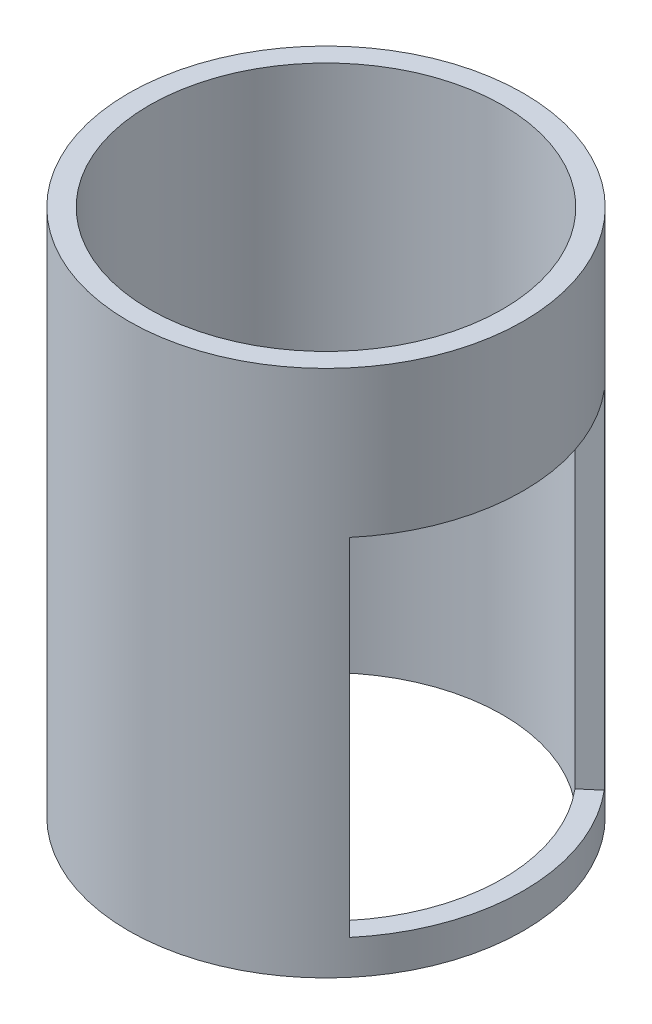
from build123d import *

# Parameters (mm, degrees)
PVC_R               = 57
PVC_R_2             = 51
BOSS_EXTRUDE1_DEPTH = 76.2
CUT_EXTRUDE1_START  = -110
CUT_EXTRUDE1_DEPTH  = 100


with BuildPart() as part:
    # PVC → Boss-Extrude1 (new, symmetric)
    with BuildSketch(Plane(origin=(0, 0, 0), x_dir=(1, 0, 0), z_dir=(0, 1, 0))):
        with Locations(Location((0, 0, 0), (0, 0, 90))):
            Circle(PVC_R)
        with Locations(Location((0, 0, 0), (0, 0, 90))):
            Circle(PVC_R_2, mode=Mode.SUBTRACT)
    extrude(amount=BOSS_EXTRUDE1_DEPTH, both=True)

    # Sketch1 → Cut-Extrude1 (cut)
    with BuildSketch(Plane.XZ.offset(76.2).offset(CUT_EXTRUDE1_START)):
        with BuildLine():
            Line((0, 0), (43.531515848, 36.796835842))
            ThreePointArc((43.531515848, 36.796835842), (57, 0), (43.531515848, -36.796835842))
            Line((43.531515848, -36.796835842), (0, 0))
        make_face()
    extrude(amount=CUT_EXTRUDE1_DEPTH, mode=Mode.SUBTRACT)


solid = part.part
